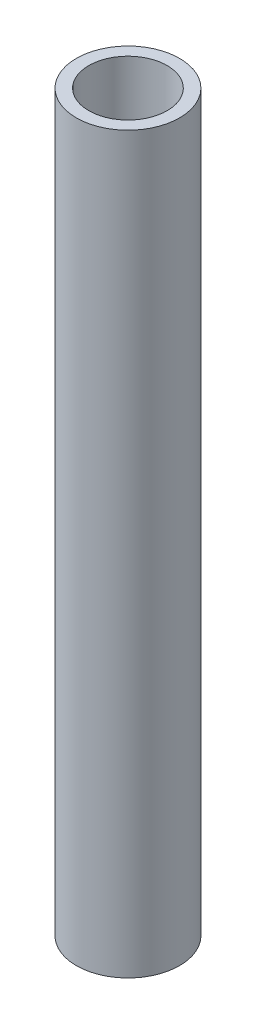
from build123d import *

# Parameters (mm, degrees)
SKETCH1_R           = 1.054
SKETCH1_R_2         = 0.8
BOSS_EXTRUDE1_DEPTH = 15


with BuildPart() as part:
    # Sketch1 → Boss-Extrude1 (new body)
    with BuildSketch(Plane(origin=(0, 0, 0), x_dir=(1, 0, 0), z_dir=(0, 1, 0))):
        with Locations(Location((0, 0, 0), (0, 0, 270))):
            Circle(SKETCH1_R)
        with Locations(Location((0, 0, 0), (0, 0, 270))):
            Circle(SKETCH1_R_2, mode=Mode.SUBTRACT)
    extrude(amount=BOSS_EXTRUDE1_DEPTH)


solid = part.part
